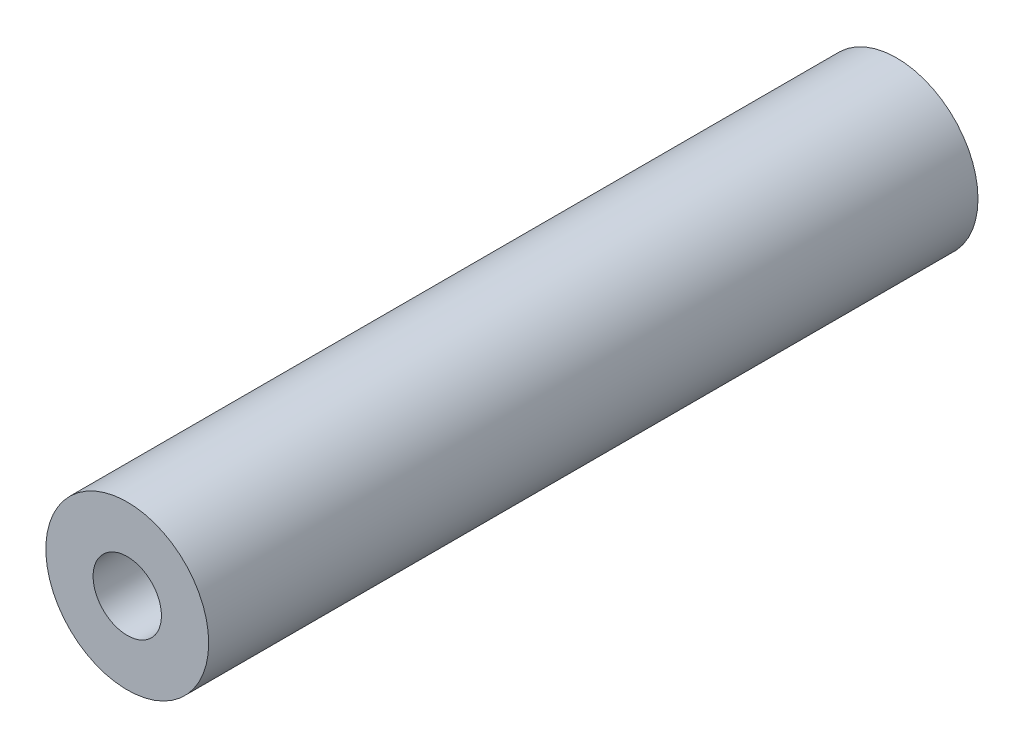
from build123d import *

# Parameters (mm, degrees)
SKETCH1_R           = 6.35
SKETCH1_R_2         = 2.665
BOSS_EXTRUDE1_DEPTH = 60


with BuildPart() as part:
    # Sketch1 → Boss-Extrude1 (new body)
    with BuildSketch(Plane.XY):
        Circle(SKETCH1_R)
        Circle(SKETCH1_R_2, mode=Mode.SUBTRACT)
    extrude(amount=BOSS_EXTRUDE1_DEPTH)


solid = part.part
